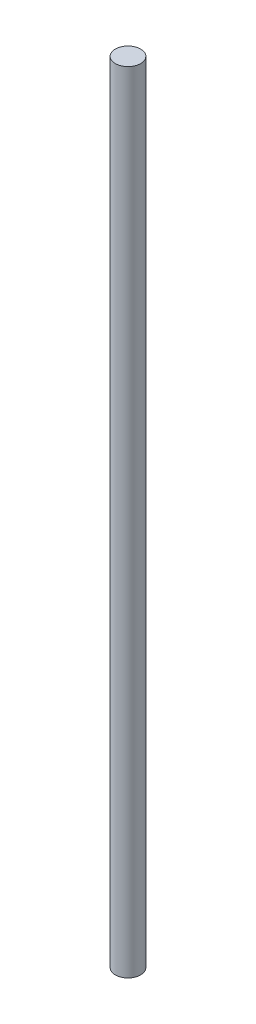
from build123d import *

# Parameters (mm, degrees)
SKETCH1_R           = 0.4
BOSS_EXTRUDE1_DEPTH = 25


with BuildPart() as part:
    # Sketch1 → Boss-Extrude1 (new body)
    with BuildSketch(Plane(origin=(0, 0, 0), x_dir=(1, 0, 0), z_dir=(0, 1, 0))):
        with Locations(Location((0, 0, 0), (0, 0, 270))):
            Circle(SKETCH1_R)
    extrude(amount=BOSS_EXTRUDE1_DEPTH)


solid = part.part
